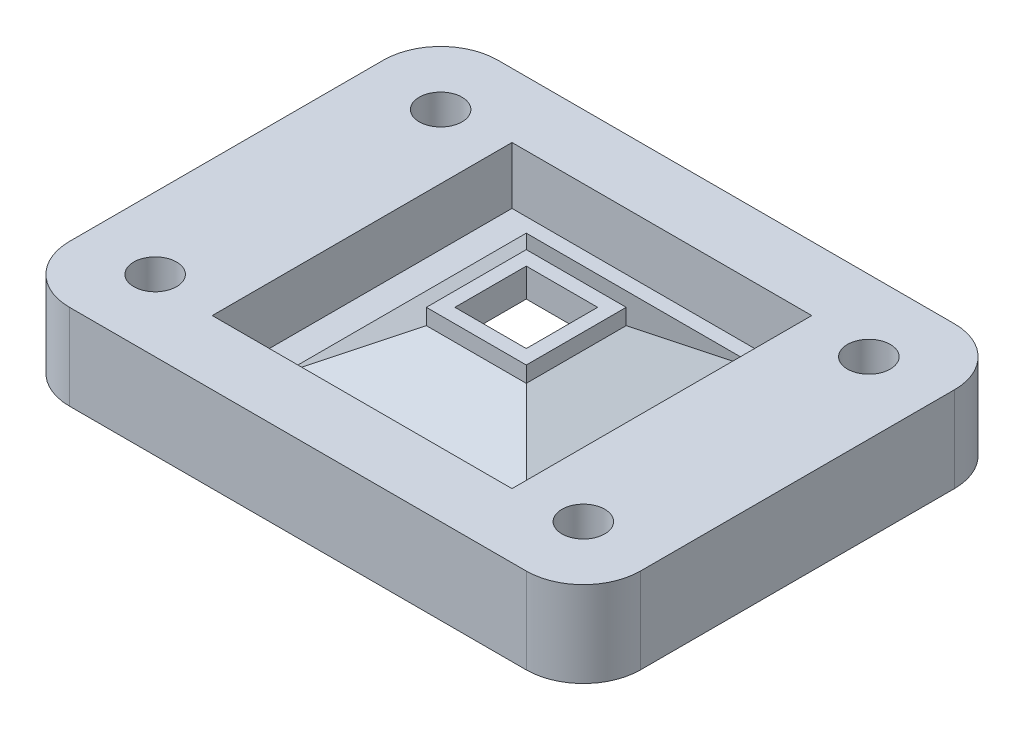
from build123d import *
from OCP.BRepFilletAPI import BRepFilletAPI_MakeChamfer

# Parameters (mm, degrees)
SKETCH1_W           = 40
SKETCH1_H           = 30
BOSS_EXTRUDE1_DEPTH = 6
SKETCH2_R           = 1.5
CUT_EXTRUDE1_DEPTH  = 6
FILLET1_R           = 4
SKETCH3_W           = 21
SKETCH3_H           = 21
CUT_EXTRUDE2_DEPTH  = 4
SKETCH6_W           = 5
SKETCH6_H           = 5
CUT_EXTRUDE3_DEPTH  = 2
SKETCH7_W           = 7
SKETCH7_H           = 7
SKETCH7_W_2         = 5
SKETCH7_H_2         = 5
BOSS_EXTRUDE2_DEPTH = 4
CHAMFER1_SIZE       = 4
CHAMFER1_SIZE2      = 6.92820323
CHAMFER2_SIZE       = 5
CHAMFER2_SIZE2      = 2.886751346


with BuildPart() as part:
    # Sketch1 → Boss-Extrude1 (new body)
    with BuildSketch(Plane(origin=(0, 0, 0), x_dir=(1, 0, 0), z_dir=(0, 1, 0))):
        with Locations((20, 15)):
            Rectangle(SKETCH1_W, SKETCH1_H)
    extrude(amount=BOSS_EXTRUDE1_DEPTH)

    # Sketch2 → Cut-Extrude1 (cut)
    with BuildSketch(Plane(origin=(0, 6, 0), x_dir=(1, 0, 0), z_dir=(0, 1, 0))):
        with Locations(Location((5, 5, 0), (0, 0, 270))):
            Circle(SKETCH2_R)
        with Locations(Location((5, 25, 0), (0, 0, 90))):
            Circle(SKETCH2_R)
        with Locations(Location((35, 5, 0), (0, 0, 90))):
            Circle(SKETCH2_R)
        with Locations(Location((35, 25, 0), (0, 0, 270))):
            Circle(SKETCH2_R)
    extrude(amount=-CUT_EXTRUDE1_DEPTH, mode=Mode.SUBTRACT)

    # Fillet1
    fillet1_edges = [part.edges().sort_by_distance(p)[0] for p in [
        (0, 3, -30),
        (40, 3, -30),
        (40, 3, 0),
        (0, 3, 0),
    ]]
    fillet(fillet1_edges, radius=FILLET1_R)

    # Sketch3 → Cut-Extrude2 (cut)
    with BuildSketch(Plane(origin=(0, 6, 0), x_dir=(1, 0, 0), z_dir=(0, 1, 0))):
        with Locations((20, 15)):
            Rectangle(SKETCH3_W, SKETCH3_H)
    extrude(amount=-CUT_EXTRUDE2_DEPTH, mode=Mode.SUBTRACT)

    # Sketch6 → Cut-Extrude3 (cut)
    with BuildSketch(Plane(origin=(0, 2, 0), x_dir=(1, 0, 0), z_dir=(0, 1, 0))):
        with Locations((20, 16)):
            Rectangle(SKETCH6_W, SKETCH6_H)
    extrude(amount=-CUT_EXTRUDE3_DEPTH, mode=Mode.SUBTRACT)

    # Sketch7 → Boss-Extrude2 (add)
    with BuildSketch(Plane(origin=(0, 2, 0), x_dir=(1, 0, 0), z_dir=(0, 1, 0))):
        with Locations((20, 16)):
            Rectangle(SKETCH7_W, SKETCH7_H)
        with Locations((20, 16)):
            Rectangle(SKETCH7_W_2, SKETCH7_H_2, mode=Mode.SUBTRACT)
    extrude(amount=BOSS_EXTRUDE2_DEPTH)

    # Chamfer1: one chamfer whose edges measure the first distance from different faces: ONE call of the kernel's chamfer builder (chamfer() names one face for all edges)
    chamfer1_edges_1 = [part.edges().sort_by_distance(p)[0] for p in [
        (20, 0, -13.5),
    ]]
    chamfer1_side_1 = [part.faces().sort_by_distance(p)[0] for p in [
        (20, 3, -13.5),
    ]]
    chamfer1_edges_2 = [part.edges().sort_by_distance(p)[0] for p in [
        (22.5, 0, -16),
    ]]
    chamfer1_side_2 = [part.faces().sort_by_distance(p)[0] for p in [
        (22.5, 3, -16),
    ]]
    chamfer1_edges_3 = [part.edges().sort_by_distance(p)[0] for p in [
        (20, 0, -18.5),
    ]]
    chamfer1_side_3 = [part.faces().sort_by_distance(p)[0] for p in [
        (20, 3, -18.5),
    ]]
    chamfer1_edges_4 = [part.edges().sort_by_distance(p)[0] for p in [
        (17.5, 0, -16),
    ]]
    chamfer1_side_4 = [part.faces().sort_by_distance(p)[0] for p in [
        (17.5, 3, -16),
    ]]
    chamfer1 = BRepFilletAPI_MakeChamfer(part.part.solid().wrapped)
    for e in chamfer1_edges_1:
        chamfer1.Add(CHAMFER1_SIZE, CHAMFER1_SIZE2, e.wrapped, chamfer1_side_1[0].wrapped)  # the first distance lies on this face
    for e in chamfer1_edges_2:
        chamfer1.Add(CHAMFER1_SIZE, CHAMFER1_SIZE2, e.wrapped, chamfer1_side_2[0].wrapped)  # the first distance lies on this face
    for e in chamfer1_edges_3:
        chamfer1.Add(CHAMFER1_SIZE, CHAMFER1_SIZE2, e.wrapped, chamfer1_side_3[0].wrapped)  # the first distance lies on this face
    for e in chamfer1_edges_4:
        chamfer1.Add(CHAMFER1_SIZE, CHAMFER1_SIZE2, e.wrapped, chamfer1_side_4[0].wrapped)  # the first distance lies on this face
    add(Compound.cast(chamfer1.Shape()), mode=Mode.REPLACE)

    # Chamfer2
    chamfer2_edges = [part.edges().sort_by_distance(p)[0] for p in [
        (16.5, 2, -16),
        (20, 2, -12.5),
        (23.5, 2, -16),
        (20, 2, -19.5),
    ]]
    chamfer2_side = [part.faces().sort_by_distance(p)[0] for p in [
        (20, 2, -4.796984848),
    ]]
    chamfer(chamfer2_edges, length=CHAMFER2_SIZE, length2=CHAMFER2_SIZE2, reference=chamfer2_side[0])


solid = part.part
